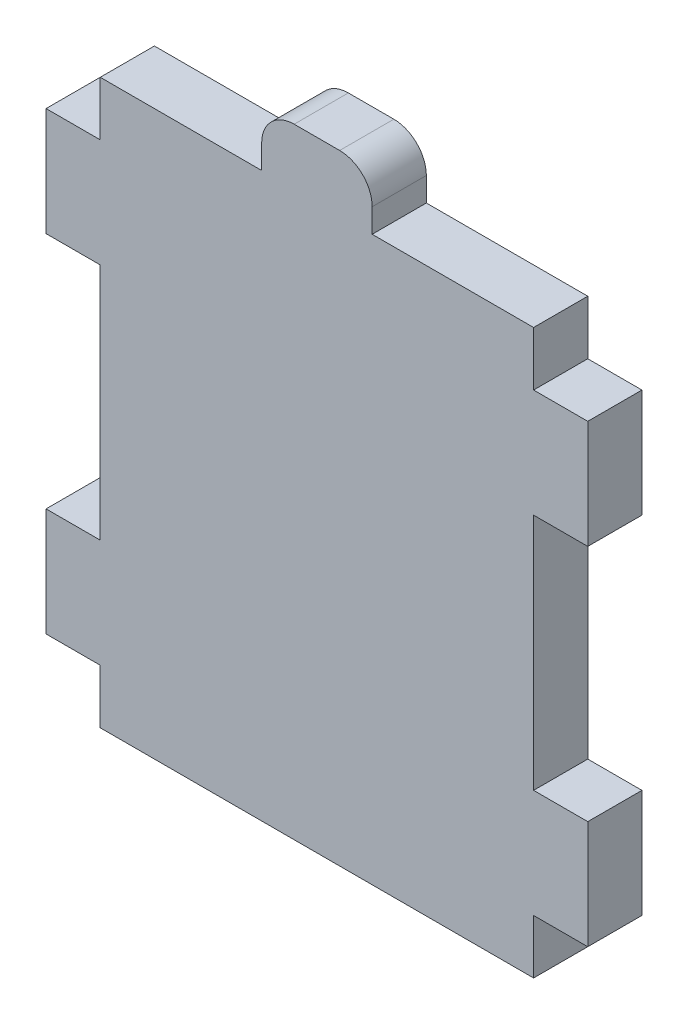
from build123d import *

# Parameters (mm, degrees)
SKETCH1_W           = 50.8
SKETCH1_H           = 66.04
BOSS_EXTRUDE1_DEPTH = 6.35
SKETCH2_W           = 6.35
SKETCH2_H           = 12.7
BOSS_EXTRUDE2_DEPTH = 6.35


with BuildPart() as part:
    # Sketch1 → Boss-Extrude1 (new body)
    with BuildSketch(Plane.XY):
        with Locations((25.4, 33.02)):
            Rectangle(SKETCH1_W, SKETCH1_H)
    extrude(amount=BOSS_EXTRUDE1_DEPTH)

    # Sketch2 → Boss-Extrude2 (add)
    with BuildSketch(Plane.XY):
        with Locations((-3.175, 53.34)):
            Rectangle(SKETCH2_W, SKETCH2_H)
        with Locations((-3.175, 12.7)):
            Rectangle(SKETCH2_W, SKETCH2_H)
        with Locations((53.975, 12.7)):
            Rectangle(SKETCH2_W, SKETCH2_H)
        with Locations((53.975, 53.34)):
            Rectangle(SKETCH2_W, SKETCH2_H)
        with BuildLine():
            Line((18.923, 66.04), (31.877, 66.04))
            Line((31.877, 66.04), (31.877, 68.834))
            ThreePointArc((31.877, 68.834), (30.761076836, 71.528076836), (28.067, 72.644))
            Line((28.067, 72.644), (22.733, 72.644))
            ThreePointArc((22.733, 72.644), (20.038923164, 71.528076836), (18.923, 68.834))
            Line((18.923, 68.834), (18.923, 66.04))
        make_face()
    extrude(amount=BOSS_EXTRUDE2_DEPTH)


solid = part.part
